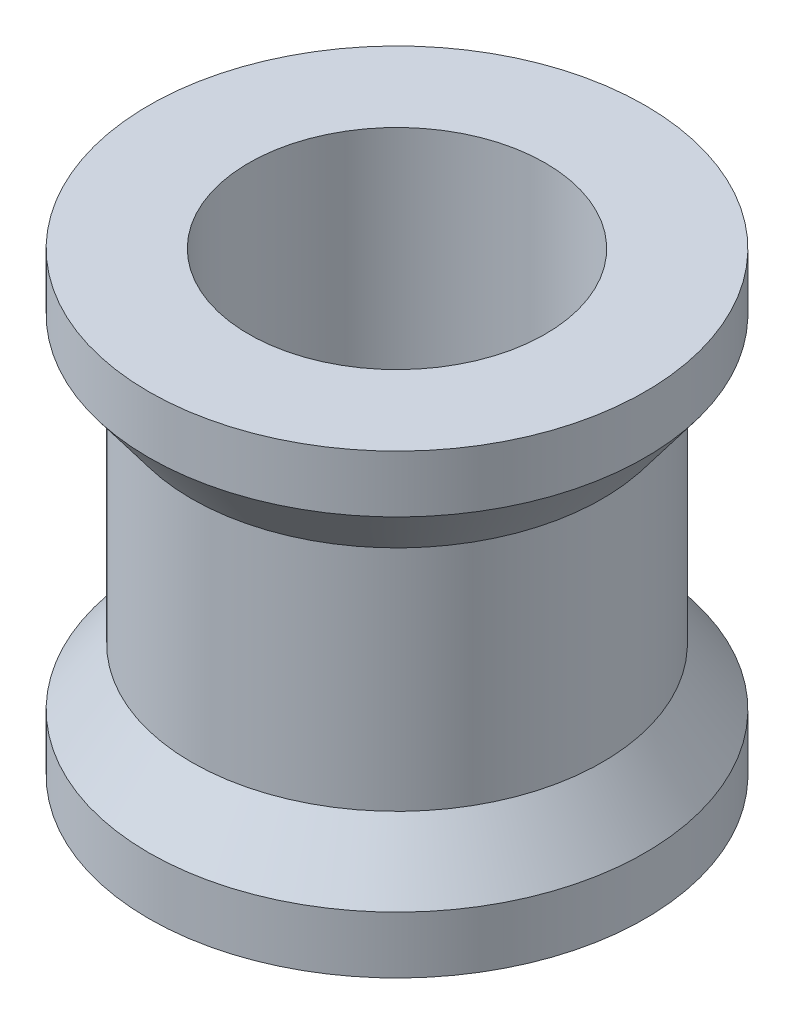
from build123d import *


with BuildPart() as part:
    # Sketch1 → Revolve1 (revolve)
    with BuildSketch(Plane.XY, mode=Mode.PRIVATE) as revolve1_sk:
        Polygon((-2.6, 8), (-2.6, 0), (-4.35, 0), (-4.35, 1), (-3.6, 2), (-3.6, 6), (-4.35, 7), (-4.35, 8), align=None)
    revolve(revolve1_sk.sketch.rotate(Axis((0, 0, 0), (0, 1, 0)), 270), axis=Axis((0, 0, 0), (0, 1, 0)))


solid = part.part
